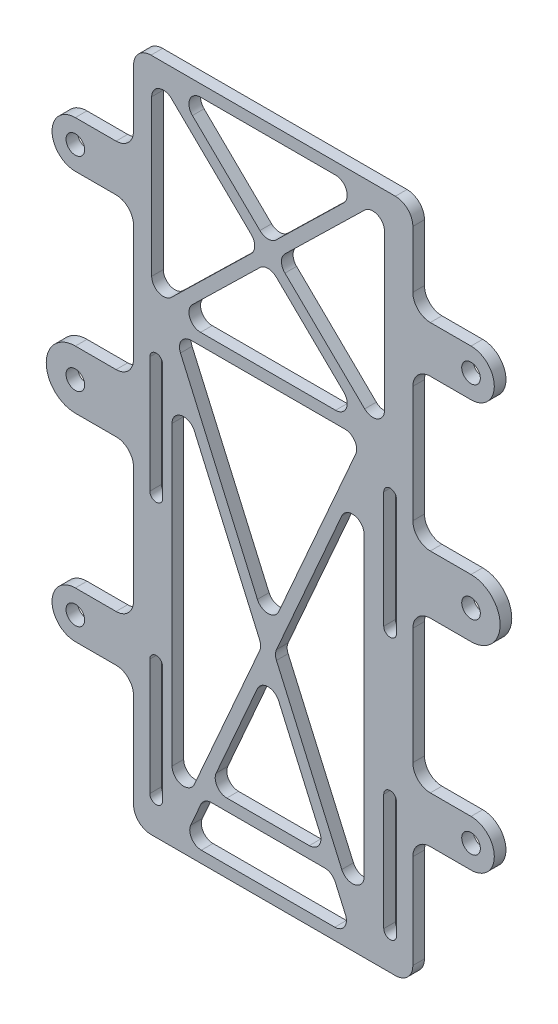
from build123d import *

# Parameters (mm, degrees)
SKETCH_1_W               = 48
SKETCH_1_H               = 116
EXTRUDE_1_DEPTH          = 2
CUT_EXTRUDE_1_DEPTH      = 63.801273872
EXTRUDE_4_DEPTH          = 2
FILLET_2_R               = 2
SKETCH_7_R               = 1.6
EXTRUDE_5_DEPTH          = 2
PATTERN_LINEAR_1_COUNT   = 2
PATTERN_LINEAR_1_PITCH   = 70
MIRROR_1_COPY_1_SKETCH_R = 1.6
MIRROR_1_COPY_1_DEPTH    = 2
FILLET_4_R               = 3
FILLET_5_R               = 3
SKETCH_8_R               = 1.6
EXTRUDE_6_DEPTH          = 2
FILLET_6_R               = 3


with BuildPart() as part:
    # 草图1 → 凸台-拉伸1 (new body)
    with BuildSketch(Plane.XY):
        Rectangle(SKETCH_1_W, SKETCH_1_H)
        with BuildLine():
            Line((-19, -32), (-19, -52))
            ThreePointArc((-19, -52), (-20.1, -53.1), (-21.2, -52))
            Line((-21.2, -52), (-21.2, -32))
            ThreePointArc((-21.2, -32), (-20.1, -30.9), (-19, -32))
        make_face(mode=Mode.SUBTRACT)
        with BuildLine():
            Line((19, -32), (19, -52))
            ThreePointArc((19, -52), (20.1, -53.1), (21.2, -52))
            Line((21.2, -52), (21.2, -32))
            ThreePointArc((21.2, -32), (20.1, -30.9), (19, -32))
        make_face(mode=Mode.SUBTRACT)
        with BuildLine():
            Line((-19, 13), (-19, -7))
            ThreePointArc((-19, -7), (-20.1, -8.1), (-21.2, -7))
            Line((-21.2, -7), (-21.2, 13))
            ThreePointArc((-21.2, 13), (-20.1, 14.1), (-19, 13))
        make_face(mode=Mode.SUBTRACT)
        with BuildLine():
            Line((19, 13), (19, -7))
            ThreePointArc((19, -7), (20.1, -8.1), (21.2, -7))
            Line((21.2, -7), (21.2, 13))
            ThreePointArc((21.2, 13), (20.1, 14.1), (19, 13))
        make_face(mode=Mode.SUBTRACT)
    extrude(amount=EXTRUDE_1_DEPTH)

    # 草图3 → 切除-拉伸1 (cut, through all)
    with BuildSketch(Plane.XY.offset(2)):
        with BuildLine():
            Line((12.342439932, 19), (-14.102439932, 19))
            ThreePointArc((-14.102439932, 19), (-15.77739582, 18.092942254), (-15.933069997, 16.194522771))
            Line((-15.933069997, 16.194522771), (-2.710630065, -13.856477074))
            ThreePointArc((-2.710630065, -13.856477074), (-0.88, -15.050999845), (0.950630065, -13.856477074))
            Line((0.950630065, -13.856477074), (14.173069997, 16.194522771))
            ThreePointArc((14.173069997, 16.194522771), (14.01739582, 18.092942254), (12.342439932, 19))
        make_face()
        with BuildLine():
            Line((15.62, 5.0055453), (15.62, -46.0055453))
            ThreePointArc((15.62, -46.0055453), (14.031545787, -47.962744846), (11.789369935, -46.811022528))
            Line((11.789369935, -46.811022528), (0.566930003, -21.305477229))
            ThreePointArc((0.566930003, -21.305477229), (0.397560068, -20.5), (0.566930003, -19.694522771))
            Line((0.566930003, -19.694522771), (11.789369935, 5.811022528))
            ThreePointArc((11.789369935, 5.811022528), (14.031545787, 6.962744846), (15.62, 5.0055453))
        make_face()
        with BuildLine():
            Line((10.582439932, -56), (-12.342439932, -56))
            ThreePointArc((-12.342439932, -56), (-14.01739582, -55.092942254), (-14.173069997, -53.194522771))
            Line((-14.173069997, -53.194522771), (-2.710630065, -27.143522926))
            ThreePointArc((-2.710630065, -27.143522926), (-0.88, -25.949000155), (0.950630065, -27.143522926))
            Line((0.950630065, -27.143522926), (12.413069997, -53.194522771))
            ThreePointArc((12.413069997, -53.194522771), (12.25739582, -55.092942254), (10.582439932, -56))
        make_face()
        with BuildLine():
            Line((-17.38, 5.0055453), (-17.38, -46.0055453))
            ThreePointArc((-17.38, -46.0055453), (-15.791545787, -47.962744846), (-13.549369935, -46.811022528))
            Line((-13.549369935, -46.811022528), (-2.326930003, -21.305477229))
            ThreePointArc((-2.326930003, -21.305477229), (-2.157560068, -20.5), (-2.326930003, -19.694522771))
            Line((-2.326930003, -19.694522771), (-13.549369935, 5.811022528))
            ThreePointArc((-13.549369935, 5.811022528), (-15.791545787, 6.962744846), (-17.38, 5.0055453))
        make_face()
        with BuildLine():
            Line((10.720058136, 56), (-12.480058136, 56))
            ThreePointArc((-12.480058136, 56), (-14.332624, 54.753657562), (-13.876258409, 52.567999721))
            Line((-13.876258409, 52.567999721), (-2.276200272, 41.257943038))
            ThreePointArc((-2.276200272, 41.257943038), (-0.88, 40.689943317), (0.516200272, 41.257943038))
            Line((0.516200272, 41.257943038), (12.116258409, 52.567999721))
            ThreePointArc((12.116258409, 52.567999721), (12.572624, 54.753657562), (10.720058136, 56))
        make_face()
        with BuildLine():
            Line((19.12, 51.860056683), (19.12, 25.139943317))
            ThreePointArc((19.12, 25.139943317), (17.897045512, 23.297065059), (15.723799728, 23.707943038))
            Line((15.723799728, 23.707943038), (2.021177489, 37.067999721))
            ThreePointArc((2.021177489, 37.067999721), (1.417377761, 38.5), (2.021177489, 39.932000279))
            Line((2.021177489, 39.932000279), (15.723799728, 53.292056962))
            ThreePointArc((15.723799728, 53.292056962), (17.897045512, 53.702934941), (19.12, 51.860056683))
        make_face()
        with BuildLine():
            Line((10.720058136, 21), (-12.480058136, 21))
            ThreePointArc((-12.480058136, 21), (-14.332624, 22.246342438), (-13.876258409, 24.432000279))
            Line((-13.876258409, 24.432000279), (-2.276200272, 35.742056962))
            ThreePointArc((-2.276200272, 35.742056962), (-0.88, 36.310056683), (0.516200272, 35.742056962))
            Line((0.516200272, 35.742056962), (12.116258409, 24.432000279))
            ThreePointArc((12.116258409, 24.432000279), (12.572624, 22.246342438), (10.720058136, 21))
        make_face()
        with BuildLine():
            Line((-20.88, 51.860056683), (-20.88, 25.139943317))
            ThreePointArc((-20.88, 25.139943317), (-19.657045512, 23.297065059), (-17.483799728, 23.707943038))
            Line((-17.483799728, 23.707943038), (-3.781177489, 37.067999721))
            ThreePointArc((-3.781177489, 37.067999721), (-3.177377761, 38.5), (-3.781177489, 39.932000279))
            Line((-3.781177489, 39.932000279), (-17.483799728, 53.292056962))
            ThreePointArc((-17.483799728, 53.292056962), (-19.657045512, 53.702934941), (-20.88, 51.860056683))
        make_face()
    extrude(amount=-CUT_EXTRUDE_1_DEPTH, mode=Mode.SUBTRACT)

    # 草图6 → 凸台-拉伸4 (add)
    with BuildSketch(Plane(origin=(0, 0, 0), x_dir=(-1, 0, 0), z_dir=(0, 0, -1))):
        Polygon((-10.149479977, -48.05), (11.909479977, -48.05), (11.029479977, -46.05), (-9.269479977, -46.05), align=None)
    extrude(amount=-EXTRUDE_4_DEPTH)

    # 圆角2
    fillet_2_edges = [part.edges().sort_by_distance(p)[0] for p in [
        (10.149479977, -48.05, 1),
        (9.269479977, -46.05, 1),
        (-11.029479977, -46.05, 1),
        (-11.909479977, -48.05, 1),
    ]]
    fillet(fillet_2_edges, radius=FILLET_2_R)

    # 草图7 → 凸台-拉伸5 (add)
    with BuildSketch(Plane(origin=(0, 0, 0), x_dir=(-1, 0, 0), z_dir=(0, 0, -1))):
        with BuildLine():
            Line((24, -35.8), (34, -35.8))
            ThreePointArc((34, -35.8), (38, -31.8), (34, -27.8))
            Line((34, -27.8), (24, -27.8))
            Line((24, -27.8), (24, -35.8))
        make_face()
        with Locations((34, -31.8)):
            Circle(SKETCH_7_R, mode=Mode.SUBTRACT)
    extrude_5 = extrude(amount=-EXTRUDE_5_DEPTH)

    # 阵列(线性)1: 凸台-拉伸5 ×2
    with Locations(*[(0, i * PATTERN_LINEAR_1_PITCH, 0) for i in range(1, PATTERN_LINEAR_1_COUNT)]):
        add(extrude_5)

    # 镜向1: 凸台-拉伸5 across plane
    add(extrude_5.mirror(Plane(origin=(0, 0, 0), x_dir=(0, 0, 1), z_dir=(1, 0, 0))))

    # 镜向1 copy 1 sketch → 镜向1 copy 1 (add)
    with BuildSketch(Plane(origin=(0, 70, 0), x_dir=(1, 0, 0), z_dir=(0, 0, -1))):
        with BuildLine():
            Line((24, 35.8), (34, 35.8))
            ThreePointArc((34, 35.8), (38, 31.8), (34, 27.8))
            Line((34, 27.8), (24, 27.8))
            Line((24, 27.8), (24, 35.8))
        make_face()
        with Locations((34, 31.8)):
            Circle(MIRROR_1_COPY_1_SKETCH_R, mode=Mode.SUBTRACT)
    extrude(amount=-MIRROR_1_COPY_1_DEPTH)

    # 圆角4
    fillet_4_edges = [part.edges().sort_by_distance(p)[0] for p in [
        (-24, 58, 1),
        (24, 58, 1),
        (24, -58, 1),
        (-24, -58, 1),
    ]]
    fillet(fillet_4_edges, radius=FILLET_4_R)

    # 圆角5
    fillet_5_edges = [part.edges().sort_by_distance(p)[0] for p in [
        (-24, -35.8, 1),
        (-24, -27.8, 1),
        (-24, 34.2, 1),
        (-24, 42.2, 1),
        (24, -27.8, 1),
        (24, -35.8, 1),
        (24, 42.2, 1),
        (24, 34.2, 1),
    ]]
    fillet(fillet_5_edges, radius=FILLET_5_R)

    # 草图8 → 凸台-拉伸6 (add)
    # profile 1 of 2: a face of its own
    with BuildSketch(Plane.XY.offset(2)):
        with BuildLine():
            Line((-34, -1.8), (-24, -1.8))
            Line((-24, -1.8), (-24, 8.2))
            Line((-24, 8.2), (-34, 8.2))
            ThreePointArc((-34, 8.2), (-39, 3.2), (-34, -1.8))
        make_face()
        with Locations((-34, 3.2)):
            Circle(SKETCH_8_R, mode=Mode.SUBTRACT)
    # profile 2 of 2: a face of its own
    with BuildSketch(Plane.XY.offset(2)):
        with BuildLine():
            Line((24, 8.2), (24, -1.8))
            Line((24, -1.8), (34, -1.8))
            ThreePointArc((34, -1.8), (39, 3.2), (34, 8.2))
            Line((34, 8.2), (24, 8.2))
        make_face()
        with Locations(Location((34, 3.2, 0), (0, 0, 180))):
            Circle(SKETCH_8_R, mode=Mode.SUBTRACT)
    extrude(amount=-EXTRUDE_6_DEPTH)

    # 圆角6
    fillet_6_edges = [part.edges().sort_by_distance(p)[0] for p in [
        (-24, 8.2, 1),
        (-24, -1.8, 1),
        (24, -1.8, 1),
        (24, 8.2, 1),
    ]]
    fillet(fillet_6_edges, radius=FILLET_6_R)


solid = part.part
